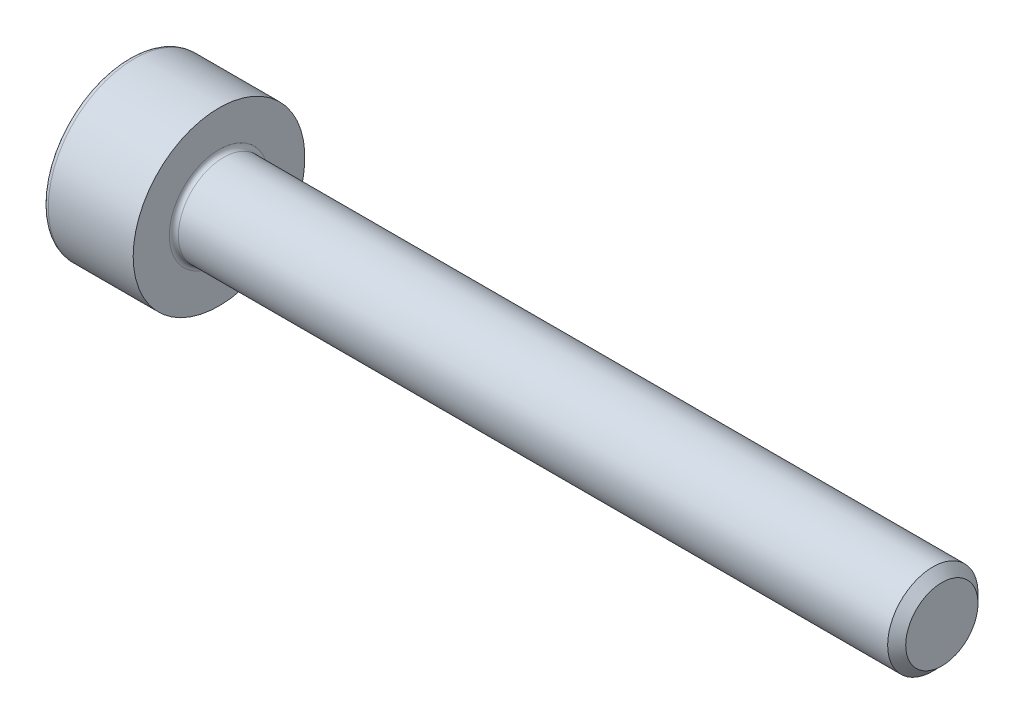
from build123d import *

# Parameters (mm, degrees)
FILLET1_R      = 0.1
FILLET2_R      = 0.12
CHAMFER1_SIZE  = 0.2
EXTRUDE1_DEPTH = 1


with BuildPart() as part:
    # Sketch1 → Revolve1 (revolve)
    with BuildSketch(Plane.XY, mode=Mode.PRIVATE) as revolve1_sk:
        Polygon((2, 1), (2, 0), (4.279914881, 0), (18, 0), (18, 1), align=None)
        Polygon((0, 1.9), (0, 0), (2, 0), (2, 1), (2, 1.9), align=None)
    revolve(revolve1_sk.sketch.rotate(Axis((0, 0, 0), (1, 0, 0)), 90), axis=Axis((0, 0, 0), (1, 0, 0)))

    # Fillet1
    fillet1_edges = [part.edges().sort_by_distance(p)[0] for p in [
        (2, 0, -1),
    ]]
    fillet(fillet1_edges, radius=FILLET1_R)

    # Fillet2
    fillet2_edges = [part.edges().sort_by_distance(p)[0] for p in [
        (0, 0, -1.9),
    ]]
    fillet(fillet2_edges, radius=FILLET2_R)

    # Chamfer1
    chamfer1_edges = [part.edges().sort_by_distance(p)[0] for p in [
        (18, 0, -1),
    ]]
    chamfer(chamfer1_edges, length=CHAMFER1_SIZE)

    # Sketch2 → Extrude1 (cut)
    with BuildSketch(Plane.ZY):
        Polygon((0, 0.866025404), (-0.75, 0.433012702), (-0.75, -0.433012702), (0, -0.866025404), (0.75, -0.433012702), (0.75, 0.433012702), align=None)
    extrude(amount=-EXTRUDE1_DEPTH, mode=Mode.SUBTRACT)


solid = part.part
